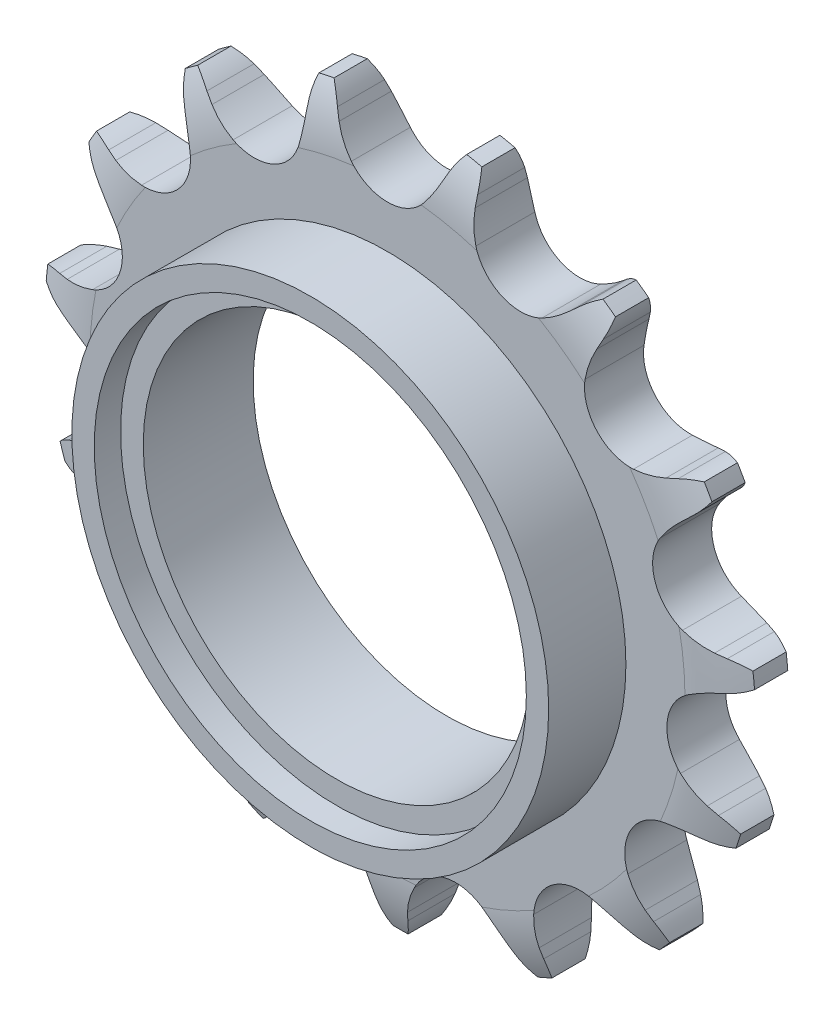
from build123d import *

# Parameters (mm, degrees)
CUT_EXTRUDE1_DEPTH              = 23.54315441
CIRPATTERN1_COUNT               = 15
BOSS_EXTRUDE1_START             = 1.3
SKETCH2_R                       = 10
BOSS_EXTRUDE1_DEPTH             = 7.4
CUT_EXTRUDE2_DEPTH              = 25.083300715
CUT_EXTRUDE2_DEPTH_BACK         = 25.083300715
SKETCH3_R                       = 3
SKETCH4_W                       = 1.95
SKETCH4_H                       = 5.584687294
CUT_EXTRUDE3_DEPTH              = 25.083300715
CUT_EXTRUDE3_DEPTH_BACK         = 25.083300715
SKETCH5_OUTSIDE_W               = 42.85
SKETCH5_OUTSIDE_H               = 42.678
SKETCH5_OUTSIDE_R               = 15.65
CUT_EXTRUDE4_DEPTH              = 24.74557098
CUT_EXTRUDE4_DEPTH_BACK         = 24.74557098
SKETCH6_R                       = 10
SKETCH7_R                       = 10.5
SKETCH7_R_2                     = 8.515
BOSS_EXTRUDE2_DEPTH             = 3.4
BOSS_EXTRUDE2_DIRECTION_2_REACH = 24.247
SKETCH8_R                       = 9.515
CUT_EXTRUDE5_DEPTH              = 1.16


with BuildPart() as part:
    # Sketch1 → Revolve1 (revolve)
    with BuildSketch(Plane(origin=(0, 0, 0), x_dir=(0, 0, -1), z_dir=(1, 0, 0))):
        with BuildLine():
            Line((1.3, 0), (-1.3, 0))
            Line((-1.3, 0), (-1.3, 13.101418106))
            ThreePointArc((-1.3, 13.101418106), (-1.122370651, 14.550555781), (-0.6, 15.913890328))
            Line((-0.6, 15.913890328), (0.6, 15.913890328))
            ThreePointArc((0.6, 15.913890328), (1.122370651, 14.550555781), (1.3, 13.101418106))
            Line((1.3, 13.101418106), (1.3, 0))
        make_face()
    revolve(axis=Axis((0, 0, -1.3), (0, 0, 1)))

    # Sketch0 → Cut-Extrude1 (cut, symmetric)
    with BuildSketch(Plane.XY):
        with BuildLine():
            Line((5.458731892, -13.819129077), (5.192148114, -13.461913404))
            ThreePointArc((5.192148114, -13.461913404), (4.769815507, -12.963915887), (4.288911093, -12.522217685))
            ThreePointArc((4.288911093, -12.522217685), (2.574176066, -12.110546227), (1.175129538, -13.184072386))
            ThreePointArc((1.175129538, -13.184072386), (0.915456339, -13.78318522), (0.732190143, -14.409906736))
            Line((0.732190143, -14.409906736), (0.633946447, -14.844668882))
            ThreePointArc((0.633946447, -14.844668882), (-0.774190712, -16.881356201), (-3.200657759, -17.374512534))
            ThreePointArc((-3.200657759, -17.374512534), (3.673146461, -17.280795438), (9.99079726, -14.570582212))
            ThreePointArc((9.99079726, -14.570582212), (7.573524561, -15.106994545), (5.458731892, -13.819129077))
        make_face()
    cut_extrude1 = extrude(amount=CUT_EXTRUDE1_DEPTH, both=True, mode=Mode.SUBTRACT)

    # CirPattern1: Cut-Extrude1 ×15 about axis
    cirpattern1_axis = Axis((0, 0, 0), (0, 0, 1))
    for i in range(1, CIRPATTERN1_COUNT):
        add(cut_extrude1.rotate(cirpattern1_axis, i * 360 / CIRPATTERN1_COUNT), mode=Mode.SUBTRACT)

    # Sketch2 → Boss-Extrude1 (add)
    with BuildSketch(Plane.XY.offset(BOSS_EXTRUDE1_START)):
        with Locations(Location((0, 0, 0), (0, 0, 270))):
            Circle(SKETCH2_R)
    extrude(amount=BOSS_EXTRUDE1_DEPTH)

    # Sketch3 → Cut-Extrude2 (cut, two sides: drawn at the far end of the back side and taken through both)
    with BuildSketch(Plane.XY.offset(-CUT_EXTRUDE2_DEPTH_BACK)):
        Circle(SKETCH3_R)
    extrude(amount=CUT_EXTRUDE2_DEPTH + CUT_EXTRUDE2_DEPTH_BACK, mode=Mode.SUBTRACT)

    # Sketch4 → Cut-Revolve1 (revolve, cut)
    with BuildSketch(Plane(origin=(0, 0, 0), x_dir=(0, 0, -1), z_dir=(1, 0, 0))):
        Polygon((-8.7, 10), (-8.7, 9.5), (-8.2, 10), align=None)
        with Locations((-2.275, 13.121546681)):
            Rectangle(SKETCH4_W, SKETCH4_H)
    revolve(axis=Axis((0, 0, -1.3), (0, 0, 1)), mode=Mode.SUBTRACT)

    # Sketch5 outside → Cut-Extrude3 (cut, two sides: drawn at the far end of the back side and taken through both)
    with BuildSketch(Plane.XY.offset(-CUT_EXTRUDE3_DEPTH_BACK)):
        with Locations((0, -0.155)):
            Rectangle(SKETCH5_OUTSIDE_W, SKETCH5_OUTSIDE_H)
        Circle(SKETCH5_OUTSIDE_R, mode=Mode.SUBTRACT)
    extrude(amount=CUT_EXTRUDE3_DEPTH + CUT_EXTRUDE3_DEPTH_BACK, mode=Mode.SUBTRACT)

    # Sketch6 → Cut-Extrude4 (cut, two sides: drawn at the far end of the back side and taken through both)
    with BuildSketch(Plane.XY.offset(-CUT_EXTRUDE4_DEPTH_BACK)):
        Circle(SKETCH6_R)
    extrude(amount=CUT_EXTRUDE4_DEPTH + CUT_EXTRUDE4_DEPTH_BACK, mode=Mode.SUBTRACT)

    # Sketch7 → Boss-Extrude2 (add)
    with BuildSketch(Plane.XY.offset(1.3)):
        Circle(SKETCH7_R)
        Circle(SKETCH7_R_2, mode=Mode.SUBTRACT)
    extrude(amount=BOSS_EXTRUDE2_DEPTH)

    # Boss-Extrude2 direction 2: up to this face of the body (flat: up to its plane)
    boss_extrude2_direction_2_end = Plane(part.part.faces().sort_by_distance((2.497256725, -11.748669179, -1.3))[0])
    # Sketch7 → Boss-Extrude2 direction 2 (add, up to the picked face)
    with BuildSketch(Plane.XY.offset(1.3), mode=Mode.PRIVATE) as boss_extrude2_direction_2_sk1:
        Circle(SKETCH7_R)
        Circle(SKETCH7_R_2, mode=Mode.SUBTRACT)
    boss_extrude2_direction_2_tool1 = split(extrude(boss_extrude2_direction_2_sk1.sketch, amount=-BOSS_EXTRUDE2_DIRECTION_2_REACH, mode=Mode.PRIVATE), bisect_by=boss_extrude2_direction_2_end, keep=Keep.BOTH, mode=Mode.PRIVATE)
    add(boss_extrude2_direction_2_tool1.solids().sort_by(Axis((-10.203015, 0, 1.3), (0, 0, -1)))[0])

    # Sketch8 → Cut-Extrude5 (cut)
    with BuildSketch(Plane.XY.offset(4.7)):
        Circle(SKETCH8_R)
    extrude(amount=-CUT_EXTRUDE5_DEPTH, mode=Mode.SUBTRACT)


solid = part.part
